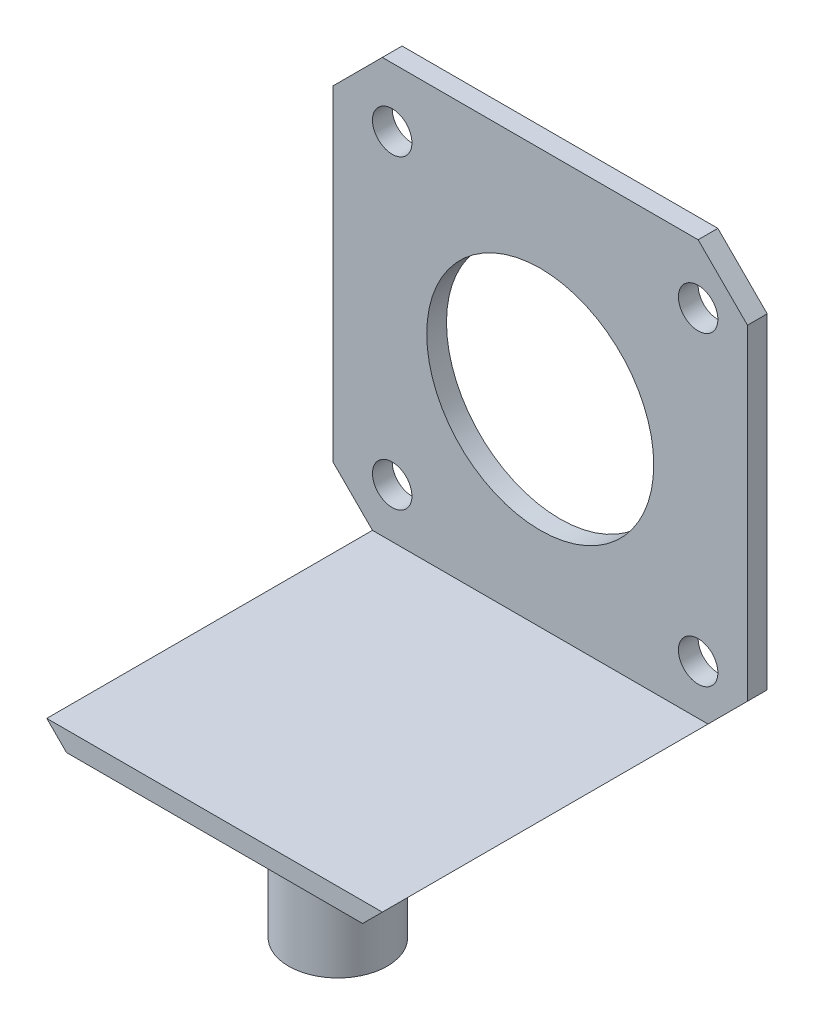
from build123d import *

# Parameters (mm, degrees)
SKETCH1_R           = 5
BOSS_EXTRUDE1_DEPTH = 15
CUT_EXTRUDE1_DEPTH  = 17.583123952
SKETCH3_W           = 42
SKETCH3_H           = 45
BOSS_EXTRUDE2_DEPTH = 2
SKETCH4_W           = 42
SKETCH4_H           = 2
BOSS_EXTRUDE3_DEPTH = 42
SKETCH6_R           = 11.5
CUT_EXTRUDE3_DEPTH  = 10
SKETCH7_W           = 42
SKETCH7_H           = 10
CUT_EXTRUDE4_DEPTH  = 10
SKETCH5_R           = 2
CUT_EXTRUDE5_DEPTH  = 10
CHAMFER1_SIZE       = 5
CHAMFER2_SIZE       = 6


with BuildPart() as part:
    # Sketch1 → Boss-Extrude1 (new body)
    with BuildSketch(Plane(origin=(0, 0, 0), x_dir=(1, 0, 0), z_dir=(0, 1, 0))):
        with Locations(Location((0, 0, 0), (0, 0, 270))):
            Circle(SKETCH1_R)
    extrude(amount=BOSS_EXTRUDE1_DEPTH)

    # Sketch2 → Cut-Extrude1 (cut, through all)
    with BuildSketch(Plane(origin=(0, 15, 0), x_dir=(1, 0, 0), z_dir=(0, 1, 0))):
        with BuildLine():
            Line((-2.28148439, 1.53535956), (-2.28148439, -1.53535956))
            ThreePointArc((-2.28148439, -1.53535956), (2.75, 0), (-2.28148439, 1.53535956))
        make_face()
    extrude(amount=-CUT_EXTRUDE1_DEPTH, mode=Mode.SUBTRACT)

    # Sketch3 → Boss-Extrude2 (add)
    with BuildSketch(Plane(origin=(0, 15, 0), x_dir=(1, 0, 0), z_dir=(0, 1, 0))):
        Rectangle(SKETCH3_W, SKETCH3_H)
    extrude(amount=BOSS_EXTRUDE2_DEPTH)

    # Sketch4 → Boss-Extrude3 (add)
    with BuildSketch(Plane(origin=(0, 17, 0), x_dir=(1, 0, 0), z_dir=(0, 1, 0))):
        with Locations((0, 21.5)):
            Rectangle(SKETCH4_W, SKETCH4_H)
    extrude(amount=BOSS_EXTRUDE3_DEPTH)

    # Sketch6 → Cut-Extrude3 (cut)
    with BuildSketch(Plane(origin=(0, 0, -22.5), x_dir=(-1, 0, 0), z_dir=(0, 0, -1))):
        with Locations((0, 37)):
            Circle(SKETCH6_R)
    extrude(amount=-CUT_EXTRUDE3_DEPTH, mode=Mode.SUBTRACT)

    # Sketch7 → Cut-Extrude4 (cut)
    with BuildSketch(Plane(origin=(0, 17, 0), x_dir=(1, 0, 0), z_dir=(0, 1, 0))):
        with Locations((0, -17.5)):
            Rectangle(SKETCH7_W, SKETCH7_H)
    extrude(amount=-CUT_EXTRUDE4_DEPTH, mode=Mode.SUBTRACT)

    # Sketch5 → Cut-Extrude5 (cut)
    with BuildSketch(Plane(origin=(0, 0, -22.5), x_dir=(-1, 0, 0), z_dir=(0, 0, -1))):
        with Locations((15, 53)):
            Circle(SKETCH5_R)
        with Locations((-16, 53)):
            Circle(SKETCH5_R)
        with Locations((15, 22)):
            Circle(SKETCH5_R)
        with Locations((-16, 22)):
            Circle(SKETCH5_R)
    extrude(amount=-CUT_EXTRUDE5_DEPTH, mode=Mode.SUBTRACT)

    # Chamfer1
    chamfer1_edges = [part.edges().sort_by_distance(p)[0] for p in [
        (-21, 59, -21.5),
        (21, 59, -21.5),
    ]]
    chamfer(chamfer1_edges, length=CHAMFER1_SIZE)

    # Chamfer2
    chamfer2_edges = [part.edges().sort_by_distance(p)[0] for p in [
        (21, 15, -5),
        (-21, 15, -5),
    ]]
    chamfer(chamfer2_edges, length=CHAMFER2_SIZE)


solid = part.part
